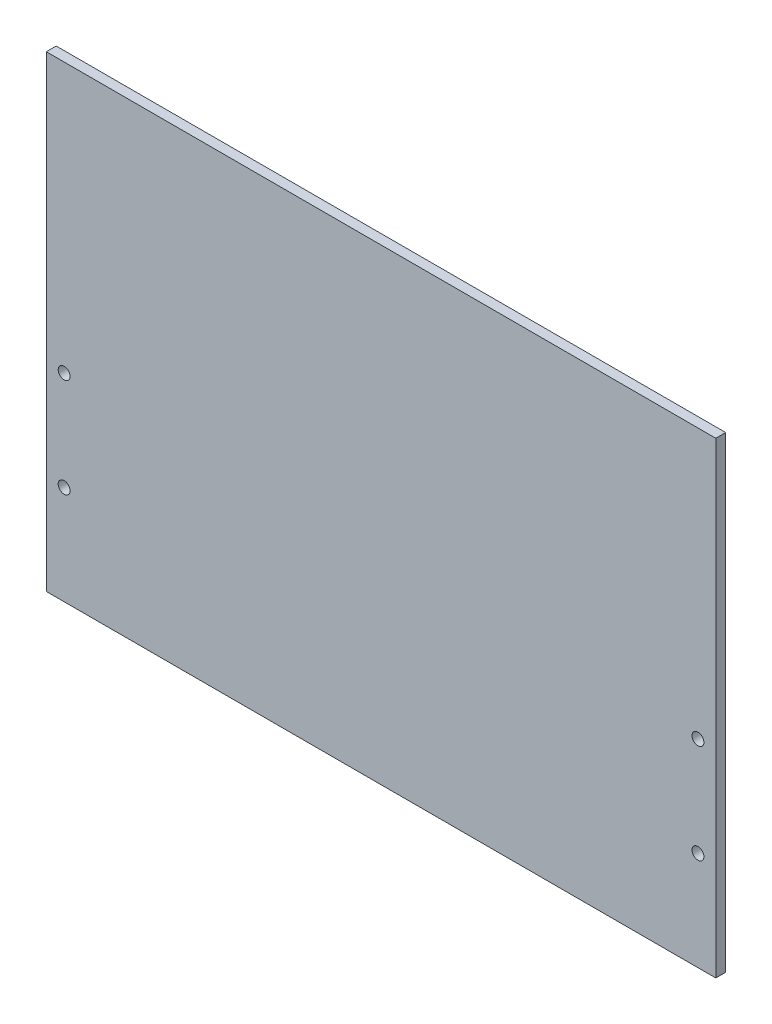
from build123d import *

# Parameters (mm, degrees)
SKETCH1_W           = 338
SKETCH1_H           = 236
SKETCH1_R           = 3
BOSS_EXTRUDE1_DEPTH = 5


with BuildPart() as part:
    # Sketch1 → Boss-Extrude1 (new body)
    with BuildSketch(Plane.XY):
        Rectangle(SKETCH1_W, SKETCH1_H)
        with Locations((-160, -68)):
            Circle(SKETCH1_R, mode=Mode.SUBTRACT)
        with Locations((-160, -18)):
            Circle(SKETCH1_R, mode=Mode.SUBTRACT)
        with Locations((160, -18)):
            Circle(SKETCH1_R, mode=Mode.SUBTRACT)
        with Locations((160, -68)):
            Circle(SKETCH1_R, mode=Mode.SUBTRACT)
    extrude(amount=BOSS_EXTRUDE1_DEPTH)


solid = part.part
